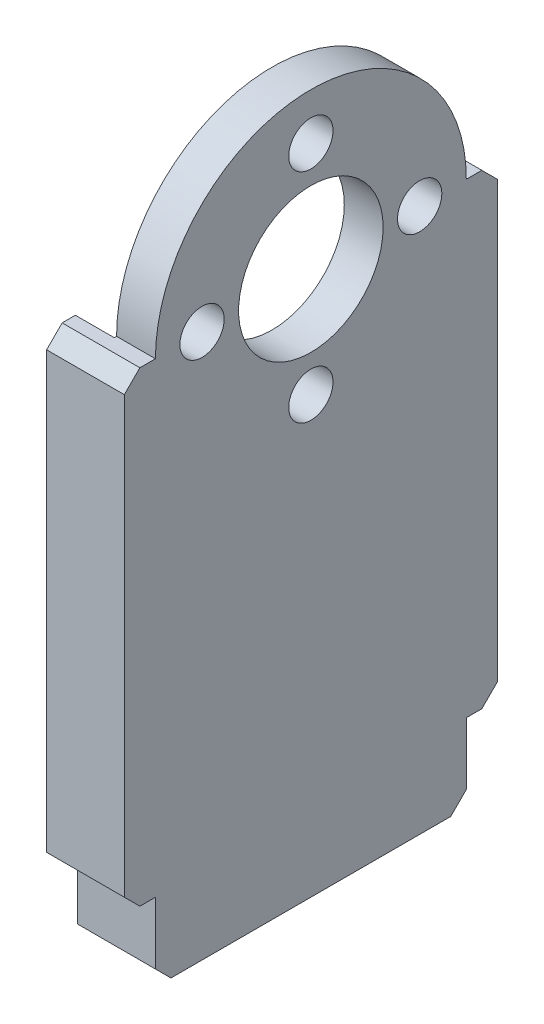
from build123d import *

# Parameters (mm, degrees)
SKETCH1_R                = 10
SKETCH1_R_2              = 4.5
SKETCH1_R_3              = 1.275
BOSS_EXTRUDE1_DEPTH      = 2.5
BOSS_EXTRUDE3_DEPTH      = 5
SKETCH2_W                = 5
SKETCH2_H                = 20
BOSS_EXTRUDE4_DEPTH      = 5
BOSS_EXTRUDE5_REACH      = 43.533
SKETCH3_W                = 2
SKETCH3_H                = 30
CHAMFER1_SIZE            = 1
CHAMFER2_SIZE            = 1
OFFSET_FOR_3D_PRINT_BY   = 0.15
OFFSET_FOR_3D_PRINT_2_BY = 0.15
OFFSET_FOR_3D_PRINT_3_BY = 0.15
OFFSET_FOR_3D_PRINT_4_BY = 0.15
OFFSET_FOR_3D_PRINT_5_BY = 0.15
OFFSET_FOR_3D_PRINT_6_BY = 0.15


with BuildPart() as part:
    # Sketch1 → Boss-Extrude1 (new body)
    with BuildSketch(Plane(origin=(0, 0, 0), x_dir=(0, 0, -1), z_dir=(1, 0, 0))):
        with Locations((0, 30)):
            Circle(SKETCH1_R)
        with Locations((0, 30)):
            Circle(SKETCH1_R_2, mode=Mode.SUBTRACT)
        with Locations((7, 30)):
            Circle(SKETCH1_R_3, mode=Mode.SUBTRACT)
        with Locations((0, 23)):
            Circle(SKETCH1_R_3, mode=Mode.SUBTRACT)
        with Locations((-7, 30)):
            Circle(SKETCH1_R_3, mode=Mode.SUBTRACT)
        with Locations((0, 37)):
            Circle(SKETCH1_R_3, mode=Mode.SUBTRACT)
    extrude(amount=-BOSS_EXTRUDE1_DEPTH)

    # Sketch1<6> → Boss-Extrude3 (add)
    with BuildSketch(Plane(origin=(0, 0, 0), x_dir=(0, 0, -1), z_dir=(1, 0, 0))):
        with BuildLine():
            ThreePointArc((10, 30), (0, 20), (-10, 30))
            Line((-10, 30), (-10, 0))
            Line((-10, 0), (10, 0))
            Line((10, 0), (10, 30))
        make_face()
    extrude(amount=-BOSS_EXTRUDE3_DEPTH)


with BuildPart() as body_2:
    # Sketch2 → Boss-Extrude4 (new body)
    with BuildSketch(Plane.XZ):
        with Locations((-2.5, 0)):
            Rectangle(SKETCH2_W, SKETCH2_H)
    extrude(amount=BOSS_EXTRUDE4_DEPTH)


with BuildPart() as part_1:
    add(part.part)

    # Combine2: union body 2
    add(body_2.part)

    # Boss-Extrude5: up to this face of the body (flat: up to its plane)
    boss_extrude5_end = Plane(part_1.part.faces().sort_by_distance((-5, 8.664765534, 0))[0])
    # Sketch3 → Boss-Extrude5 (add, up to the picked face)
    with BuildSketch(Plane(origin=(0, 0, 0), x_dir=(0, 0, -1), z_dir=(1, 0, 0)), mode=Mode.PRIVATE) as boss_extrude5_sk1:
        with Locations((11, 15)):
            Rectangle(SKETCH3_W, SKETCH3_H)
    boss_extrude5_tool1 = split(extrude(boss_extrude5_sk1.sketch, amount=-BOSS_EXTRUDE5_REACH, mode=Mode.PRIVATE), bisect_by=boss_extrude5_end, keep=Keep.BOTH, mode=Mode.PRIVATE)
    # Sketch3 → Boss-Extrude5 (add, up to the picked face)
    with BuildSketch(Plane(origin=(0, 0, 0), x_dir=(0, 0, -1), z_dir=(1, 0, 0)), mode=Mode.PRIVATE) as boss_extrude5_sk2:
        with Locations((-11, 15)):
            Rectangle(SKETCH3_W, SKETCH3_H)
    boss_extrude5_tool2 = split(extrude(boss_extrude5_sk2.sketch, amount=-BOSS_EXTRUDE5_REACH, mode=Mode.PRIVATE), bisect_by=boss_extrude5_end, keep=Keep.BOTH, mode=Mode.PRIVATE)
    add(boss_extrude5_tool1.solids().sort_by(Axis((0, 15, -11), (-1, 0, 0)))[0])
    add(boss_extrude5_tool2.solids().sort_by(Axis((0, 15, 11), (-1, 0, 0)))[0])

    # Chamfer1
    chamfer1_edges = [part_1.edges().sort_by_distance(p)[0] for p in [
        (-2.5, 0, -12),
        (-2.5, 30, -12),
        (-2.5, 30, 12),
        (-2.5, 0, 12),
    ]]
    chamfer(chamfer1_edges, length=CHAMFER1_SIZE)

    # Chamfer2
    chamfer2_edges = [part_1.edges().sort_by_distance(p)[0] for p in [
        (-2.5, -5, -10),
        (-2.5, -5, 10),
    ]]
    chamfer(chamfer2_edges, length=CHAMFER2_SIZE)

    # Offset for 3D print: a curved face moved inward by 0.15
    add(Solid.thicken(part_1.faces().sort_by_distance((-3.75, 20, 0))[0], -OFFSET_FOR_3D_PRINT_BY), mode=Mode.SUBTRACT)

    # Offset for 3D print 2: a curved face moved inward by 0.15
    add(Solid.thicken(part_1.faces().sort_by_distance((-1.25, 37, 1.275))[0], -OFFSET_FOR_3D_PRINT_2_BY), mode=Mode.SUBTRACT)

    # Offset for 3D print 3: a curved face moved inward by 0.15
    add(Solid.thicken(part_1.faces().sort_by_distance((-1.25, 23, 1.275))[0], -OFFSET_FOR_3D_PRINT_3_BY), mode=Mode.SUBTRACT)

    # Offset for 3D print 4: a curved face moved inward by 0.15
    add(Solid.thicken(part_1.faces().sort_by_distance((-1.25, 30, -5.725))[0], -OFFSET_FOR_3D_PRINT_4_BY), mode=Mode.SUBTRACT)

    # Offset for 3D print 5: a curved face moved inward by 0.15
    add(Solid.thicken(part_1.faces().sort_by_distance((-1.25, 30, 8.275))[0], -OFFSET_FOR_3D_PRINT_5_BY), mode=Mode.SUBTRACT)

    # Offset for 3D print 6: a curved face moved inward by 0.15
    add(Solid.thicken(part_1.faces().sort_by_distance((-1.25, 30, 4.5))[0], -OFFSET_FOR_3D_PRINT_6_BY), mode=Mode.SUBTRACT)


solid = part_1.part
